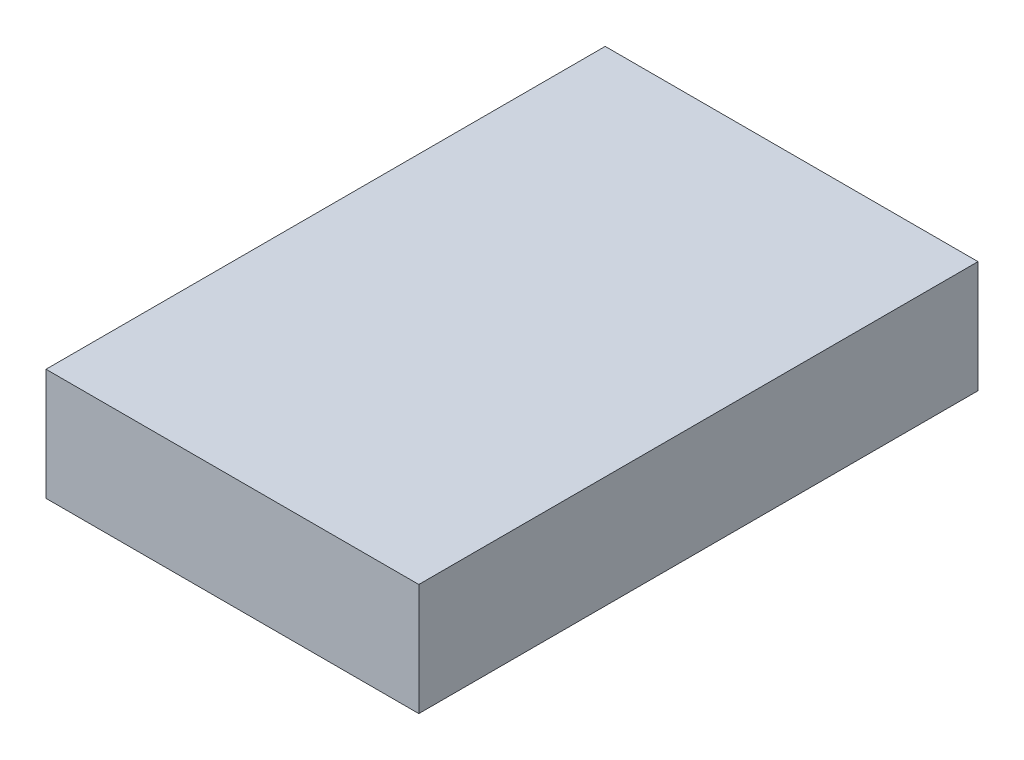
from build123d import *

# Parameters (mm, degrees)
SKETCH1_W           = 50
SKETCH1_H           = 75
BOSS_EXTRUDE1_DEPTH = 15


with BuildPart() as part:
    # Sketch1 → Boss-Extrude1 (new body)
    with BuildSketch(Plane(origin=(0, 0, 0), x_dir=(1, 0, 0), z_dir=(0, 1, 0))):
        Rectangle(SKETCH1_W, SKETCH1_H)
    extrude(amount=BOSS_EXTRUDE1_DEPTH)


solid = part.part
